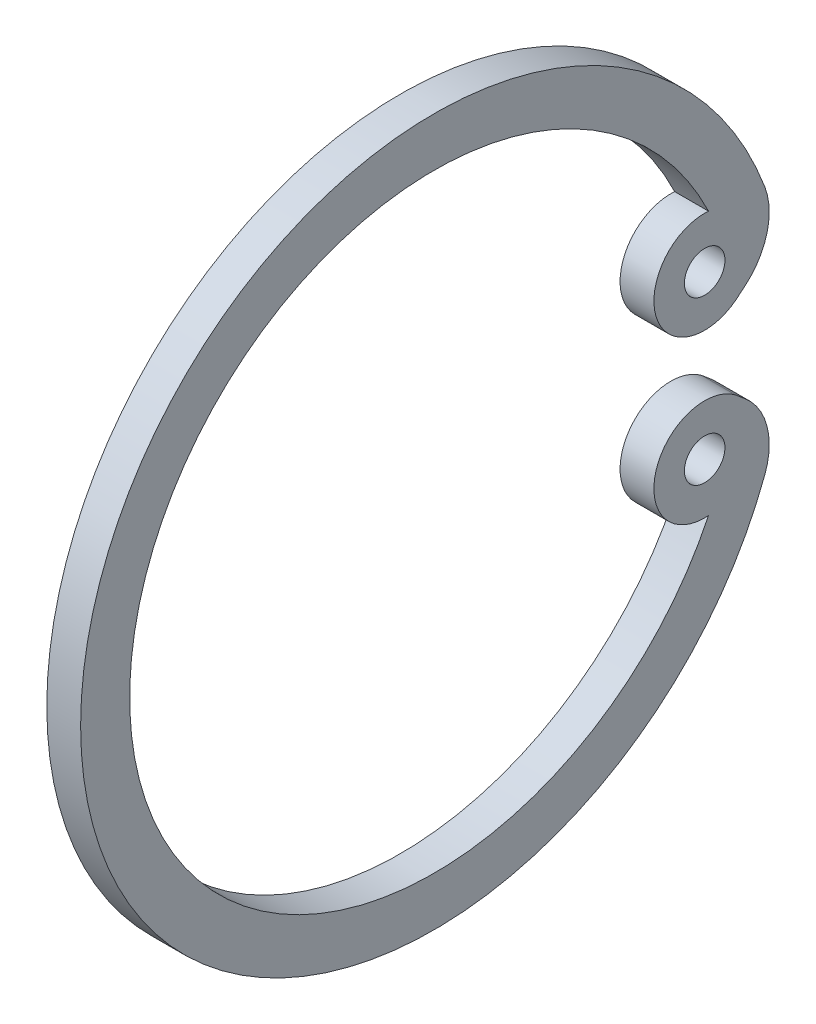
from build123d import *

# Parameters (mm, degrees)
SKETCH1_R           = 0.6
BOSS_EXTRUDE1_DEPTH = 1
SCALE2_SCALE        = 0.277777778


with BuildPart() as part:
    # Sketch1 → Boss-Extrude1 (new body)
    with BuildSketch(Plane(origin=(19, 0, 0), x_dir=(0, 0, -1), z_dir=(1, 0, 0))):
        with BuildLine():
            Line((-1.082906578, 1.214226965), (-0.806260325, 1.444819657))
            ThreePointArc((-0.806260325, 1.444819657), (-0.157167996, 2.46989624), (-0.220083072, 3.681566388))
            ThreePointArc((-0.220083072, 3.681566388), (-20.449170804, -0.000103807), (-0.220095755, -3.681843689))
            ThreePointArc((-0.220095755, -3.681843689), (-0.157177378, -2.470170425), (-0.806270581, -1.44509051))
            Line((-0.806270581, -1.44509051), (-1.082193901, -1.213563353))
            ThreePointArc((-1.082193901, -1.213563353), (-3.437745717, -1.969386585), (-1.886859109, -3.896727719))
            ThreePointArc((-1.886859109, -3.896727719), (-18.999593972, -0.000121806), (-1.886859109, 3.896484108))
            ThreePointArc((-1.886859109, 3.896484108), (-3.437385157, 1.97013231), (-1.082906578, 1.214226965))
        make_face()
        with Locations(Location((-2.00000003, -2.4, 0), (0, 0, 180))):
            Circle(SKETCH1_R, mode=Mode.SUBTRACT)
        with Locations(Location((-2.00000003, 2.4, 0), (0, 0, 180))):
            Circle(SKETCH1_R, mode=Mode.SUBTRACT)
    extrude(amount=-BOSS_EXTRUDE1_DEPTH)


with BuildPart() as part_1:
    # Scale2: scaled about (18.5, -0.000178585, 9.916688181)
    add(part.part.scale(SCALE2_SCALE).moved(Location((13.361111111, -0.000128978, 7.162052575))))


solid = part_1.part
